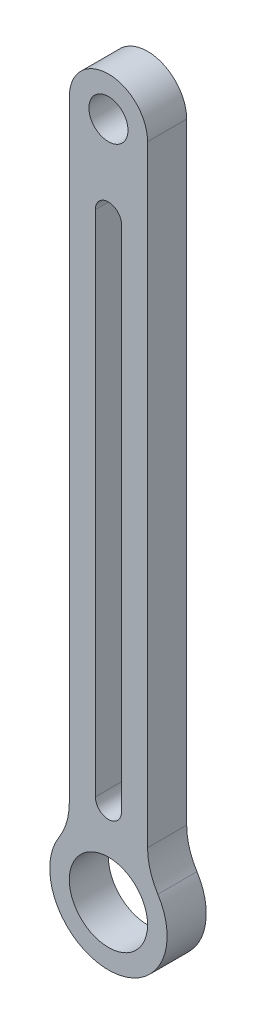
from build123d import *

# Parameters (mm, degrees)
EXTRUDE_1_DEPTH     = 6
SKETCH_2_R          = 9
EXTRUDE_2_DEPTH     = 6
SKETCH_3_R          = 6
SKETCH_3_R_2        = 3
CUT_EXTRUDE_1_DEPTH = 6
FILLET_1_R          = 10
CUT_EXTRUDE_2_DEPTH = 6


with BuildPart() as part:
    # 草图1 → 凸台-拉伸1 (new body)
    with BuildSketch(Plane.XY):
        with BuildLine():
            Line((-6, -52), (-6, 52))
            ThreePointArc((-6, 52), (0, 58), (6, 52))
            Line((6, 52), (6, -52))
            ThreePointArc((6, -52), (0, -58), (-6, -52))
        make_face()
    extrude(amount=EXTRUDE_1_DEPTH)

    # 草图2 → 凸台-拉伸2 (add)
    with BuildSketch(Plane(origin=(0, 0, 0), x_dir=(-1, 0, 0), z_dir=(0, 0, -1))):
        with Locations((0, -52)):
            Circle(SKETCH_2_R)
    extrude(amount=-EXTRUDE_2_DEPTH)

    # 草图3 → 切除-拉伸1 (cut)
    with BuildSketch(Plane(origin=(0, 0, 0), x_dir=(-1, 0, 0), z_dir=(0, 0, -1))):
        with Locations((0, -52)):
            Circle(SKETCH_3_R)
        with Locations((0, 52)):
            Circle(SKETCH_3_R_2)
    extrude(amount=-CUT_EXTRUDE_1_DEPTH, mode=Mode.SUBTRACT)

    # 圆角1
    fillet_1_edges = [part.edges().sort_by_distance(p)[0] for p in [
        (6, -45.291796068, 3),
        (-6, -45.291796068, 3),
    ]]
    fillet(fillet_1_edges, radius=FILLET_1_R)

    # 草图4 → 切除-拉伸2 (cut)
    with BuildSketch(Plane.XY.offset(6)):
        with BuildLine():
            Line((-2, -39), (-2, 39))
            ThreePointArc((-2, 39), (0, 41), (2, 39))
            Line((2, 39), (2, -39))
            ThreePointArc((2, -39), (0, -41), (-2, -39))
        make_face()
    extrude(amount=-CUT_EXTRUDE_2_DEPTH, mode=Mode.SUBTRACT)


solid = part.part
